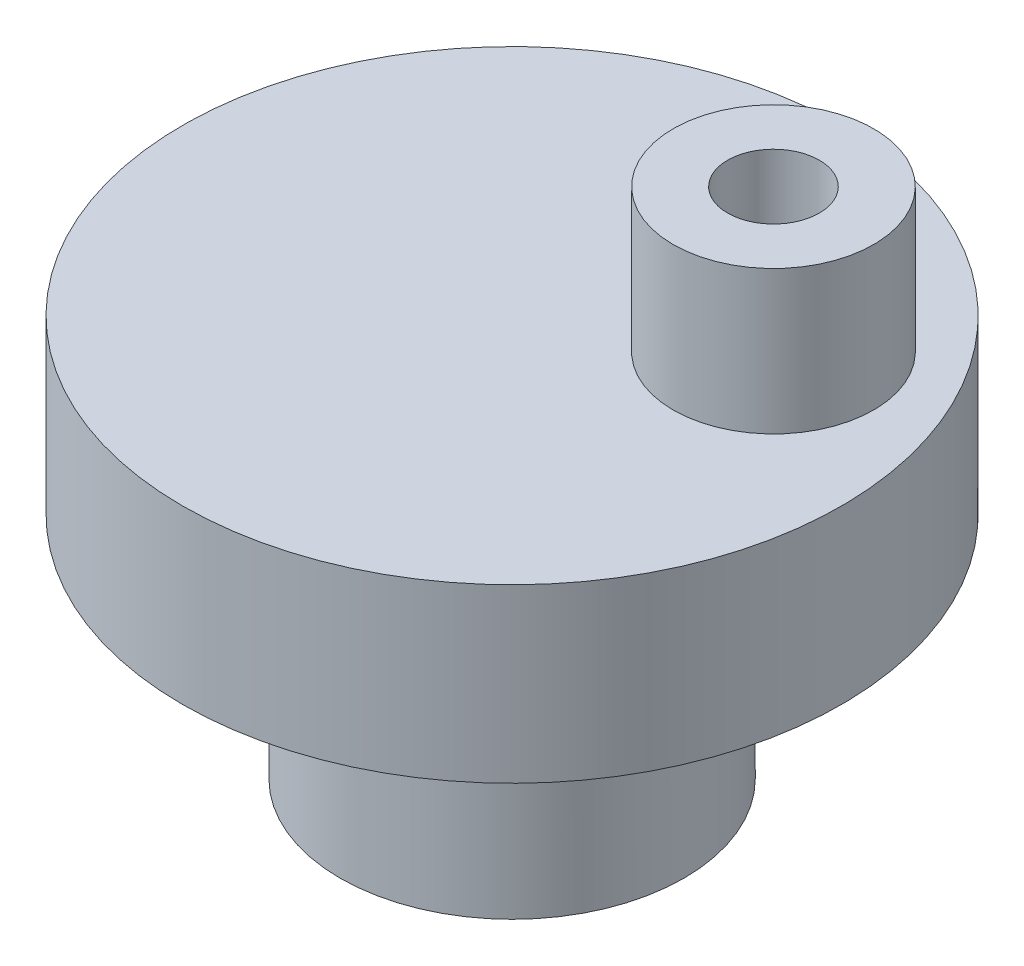
from build123d import *
from build123d.topology import SkipClean

# Parameters (mm, degrees)
SKETCH1_R           = 5.75
SKETCH1_R_2         = 1.5
BOSS_EXTRUDE1_DEPTH = 3
BOSS_EXTRUDE2_START = 4
SKETCH2_R           = 3
SKETCH2_R_2         = 1.5
BOSS_EXTRUDE2_DEPTH = 4
BOSS_EXTRUDE3_START = -7
BOSS_EXTRUDE3_DEPTH = 7
SKETCH4_R           = 1.75
SKETCH4_R_2         = 0.8
BOSS_EXTRUDE4_DEPTH = 2.5
BOSS_EXTRUDE5_START = -0.8
SKETCH5_R           = 5.75
BOSS_EXTRUDE5_DEPTH = 0.8


with BuildPart() as part:
    # Sketch1 → Boss-Extrude1 (new body)
    with BuildSketch(Plane(origin=(0, 0, 0), x_dir=(1, 0, 0), z_dir=(0, 1, 0))):
        with Locations(Location((0, 0, 0), (0, 0, 270))):
            Circle(SKETCH1_R)
        with Locations(Location((0, 0, 0), (0, 0, 270))):
            Circle(SKETCH1_R_2, mode=Mode.SUBTRACT)
    extrude(amount=BOSS_EXTRUDE1_DEPTH)

    # Sketch2 → Boss-Extrude2 (add)
    with SkipClean():  # the faces are left unmerged after this step: merging them gives an invalid solid
        with BuildSketch(Plane.XZ.offset(BOSS_EXTRUDE2_START)):
            with Locations(Location((0, 0, 0), (0, 0, 90))):
                Circle(SKETCH2_R)
            with Locations(Location((0, 0, 0), (0, 0, 270))):
                Circle(SKETCH2_R_2, mode=Mode.SUBTRACT)
        extrude(amount=-BOSS_EXTRUDE2_DEPTH)

    # Sketch3 → Boss-Extrude3 (add)
    with BuildSketch(Plane(origin=(0, 3, 0), x_dir=(1, 0, 0), z_dir=(0, 1, 0)).offset(BOSS_EXTRUDE3_START)):
        with BuildLine():
            Line((-0.878196328, -1.216047371), (0.926753921, -1.179460542))
            ThreePointArc((0.926753921, -1.179460542), (0.030399161, -1.499691932), (-0.878196328, -1.216047371))
        make_face()
    extrude(amount=BOSS_EXTRUDE3_DEPTH)

    # Sketch4 → Boss-Extrude4 (add)
    with BuildSketch(Plane(origin=(0, 3, 0), x_dir=(1, 0, 0), z_dir=(0, 1, 0))):
        with Locations(Location((2.83060587, 1.729454153, 0), (0, 0, 270))):
            Circle(SKETCH4_R)
        with Locations(Location((2.83060587, 1.729454153, 0), (0, 0, 270))):
            Circle(SKETCH4_R_2, mode=Mode.SUBTRACT)
    extrude(amount=BOSS_EXTRUDE4_DEPTH)

    # Sketch5 → Boss-Extrude5 (add)
    with BuildSketch(Plane(origin=(0, 3, 0), x_dir=(1, 0, 0), z_dir=(0, 1, 0)).offset(BOSS_EXTRUDE5_START)):
        with Locations(Location((0, 0, 0), (0, 0, 270))):
            Circle(SKETCH5_R)
    extrude(amount=BOSS_EXTRUDE5_DEPTH)


solid = part.part
